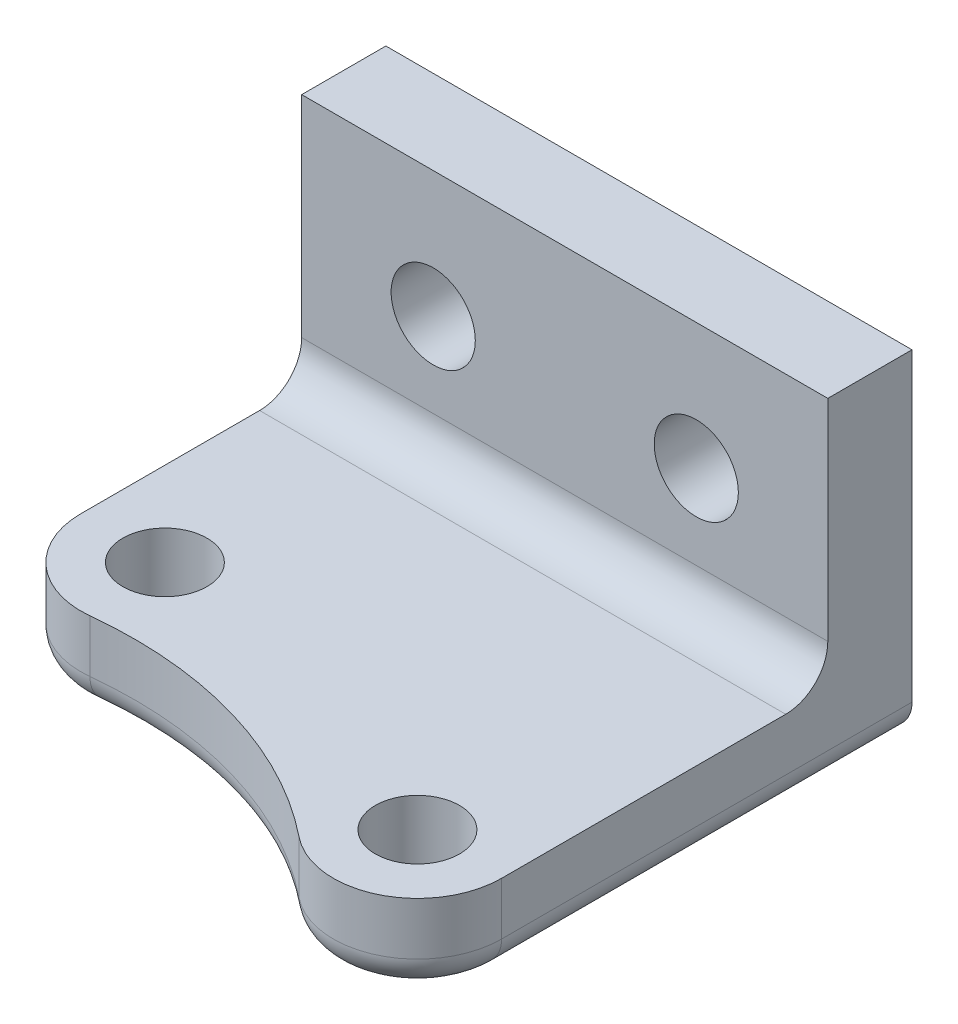
from build123d import *

# Parameters (mm, degrees)
SKETCH1_R           = 2
BOSS_EXTRUDE1_DEPTH = 4
SKETCH2_W           = 25
SKETCH2_H           = 4
BOSS_EXTRUDE2_DEPTH = 12
SKETCH3_R           = 2
CUT_EXTRUDE1_DEPTH  = 12
FILLET1_R           = 2
FILLET2_R           = 1.5


with BuildPart() as part:
    # Sketch1 → Boss-Extrude1 (new body)
    with BuildSketch(Plane(origin=(0, 0, 0), x_dir=(1, 0, 0), z_dir=(0, 1, 0))):
        with BuildLine():
            Line((-4, 14.5), (21, 14.5))
            Line((21, 14.5), (21, -5))
            ThreePointArc((21, -5), (18.728627677, -8.607193695), (14.494076823, -8.117747429))
            ThreePointArc((14.494076823, -8.117747429), (7.866380142, -4.654307517), (0.418938394, -3.978000832))
            ThreePointArc((0.418938394, -3.978000832), (-2.676214343, -2.972856671), (-4, 0))
            Line((-4, 0), (-4, 14.5))
        make_face()
        with Locations(Location((0, 0, 0), (0, 0, 270))):
            Circle(SKETCH1_R, mode=Mode.SUBTRACT)
        with Locations(Location((17, -5, 0), (0, 0, 270))):
            Circle(SKETCH1_R, mode=Mode.SUBTRACT)
    extrude(amount=BOSS_EXTRUDE1_DEPTH)

    # Sketch2 → Boss-Extrude2 (add)
    with BuildSketch(Plane(origin=(0, 4, 0), x_dir=(1, 0, 0), z_dir=(0, 1, 0))):
        with Locations((8.5, 12.5)):
            Rectangle(SKETCH2_W, SKETCH2_H)
    extrude(amount=BOSS_EXTRUDE2_DEPTH)

    # Sketch3 → Cut-Extrude1 (cut)
    with BuildSketch(Plane.XY.offset(-10.5)):
        with Locations((2.25, 10)):
            Circle(SKETCH3_R)
        with Locations((14.75, 10)):
            Circle(SKETCH3_R)
    extrude(amount=-CUT_EXTRUDE1_DEPTH, mode=Mode.SUBTRACT)

    # Fillet1
    fillet1_edges = [part.edges().sort_by_distance(p)[0] for p in [
        (8.5, 4, -10.5),
    ]]
    fillet(fillet1_edges, radius=FILLET1_R)

    # Fillet2
    fillet2_edges = [part.edges().sort_by_distance(p)[0] for p in [
        (-2.676214343, 0, 2.972856671),
        (-4, 0, -7.25),
        (21, 0, -4.75),
        (18.728627677, 0, 8.607193695),
        (7.866380142, 0, 4.654307517),
    ]]
    fillet(fillet2_edges, radius=FILLET2_R)


solid = part.part
